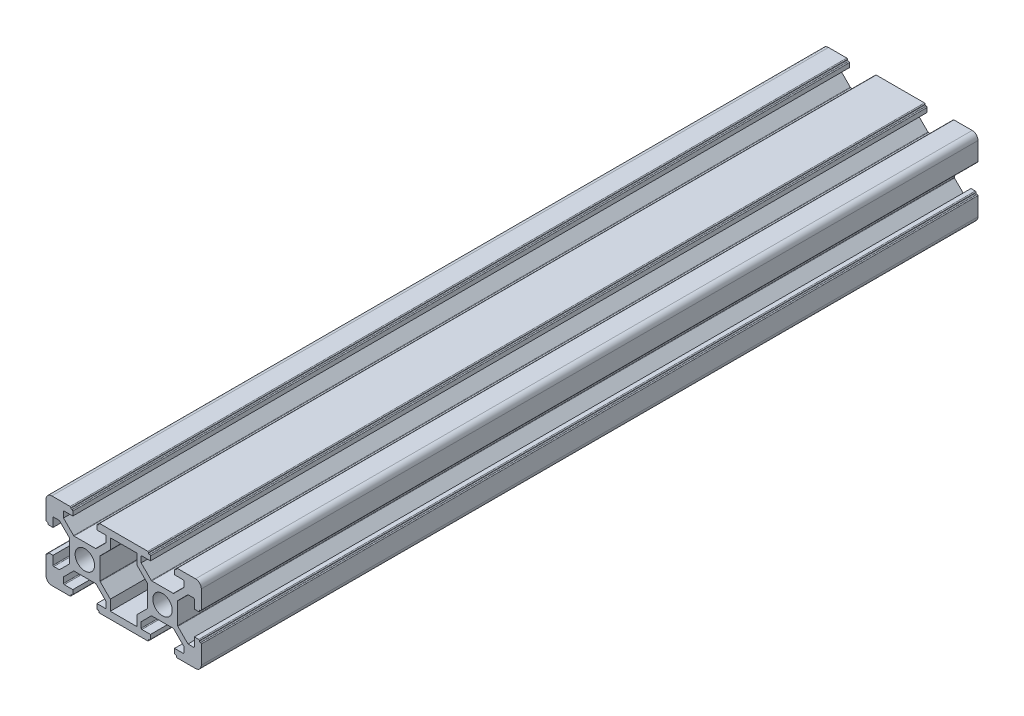
from build123d import *

# Parameters (mm, degrees)
BOSS_EXTRUDE1_DEPTH = 200
SKETCH2_R           = 2.5
CUT_EXTRUDE1_DEPTH  = 203.484567313
SKETCH3_R           = 1.5
CUT_EXTRUDE2_DEPTH  = 10


with BuildPart() as part:
    # Sketch1 → Boss-Extrude1 (new body)
    with BuildSketch(Plane.XY):
        with BuildLine():
            Line((-8.5, 10), (-3.8, 10))
            ThreePointArc((-3.8, 10), (-3.658578644, 9.941421356), (-3.6, 9.8))
            Line((-3.6, 9.8), (-3.6, 9.7))
            ThreePointArc((-3.6, 9.7), (-3.541421356, 9.558578644), (-3.4, 9.5))
            Line((-3.4, 9.5), (-3.3, 9.5))
            ThreePointArc((-3.3, 9.5), (-3.158578644, 9.441421356), (-3.1, 9.3))
            Line((-3.1, 9.3), (-3.1, 8.2))
            Line((-3.1, 8.2), (-5.3, 8.2))
            ThreePointArc((-5.3, 8.2), (-5.441421356, 8.141421356), (-5.5, 8))
            Line((-5.5, 8), (-5.5, 6.560660172))
            Line((-5.5, 6.560660172), (-2.897918472, 3.958578644))
            ThreePointArc((-2.897918472, 3.958578644), (-2.833033802, 3.915224093), (-2.756497116, 3.9))
            Line((-2.756497116, 3.9), (2.756497116, 3.9))
            ThreePointArc((2.756497116, 3.9), (2.833033802, 3.915224093), (2.897918472, 3.958578644))
            Line((2.897918472, 3.958578644), (5.5, 6.560660172))
            Line((5.5, 6.560660172), (5.5, 8))
            ThreePointArc((5.5, 8), (5.441421356, 8.141421356), (5.3, 8.2))
            Line((5.3, 8.2), (3.1, 8.2))
            Line((3.1, 8.2), (3.1, 9.3))
            ThreePointArc((3.1, 9.3), (3.158578644, 9.441421356), (3.3, 9.5))
            Line((3.3, 9.5), (3.4, 9.5))
            ThreePointArc((3.4, 9.5), (3.541421356, 9.558578644), (3.6, 9.7))
            Line((3.6, 9.7), (3.6, 9.8))
            ThreePointArc((3.6, 9.8), (3.658578644, 9.941421356), (3.8, 10))
            Line((3.8, 10), (8.5, 10))
            Line((8.5, 10), (11.5, 10))
            Line((11.5, 10), (16.2, 10))
            ThreePointArc((16.2, 10), (16.341421356, 9.941421356), (16.4, 9.8))
            Line((16.4, 9.8), (16.4, 9.7))
            ThreePointArc((16.4, 9.7), (16.458578644, 9.558578644), (16.6, 9.5))
            Line((16.6, 9.5), (16.7, 9.5))
            ThreePointArc((16.7, 9.5), (16.841421356, 9.441421356), (16.9, 9.3))
            Line((16.9, 9.3), (16.9, 8.2))
            Line((16.9, 8.2), (14.7, 8.2))
            ThreePointArc((14.7, 8.2), (14.558578644, 8.141421356), (14.5, 8))
            Line((14.5, 8), (14.5, 6.560660172))
            Line((14.5, 6.560660172), (17.102081528, 3.958578644))
            ThreePointArc((17.102081528, 3.958578644), (17.166966198, 3.915224093), (17.243502884, 3.9))
            Line((17.243502884, 3.9), (22.756497116, 3.9))
            ThreePointArc((22.756497116, 3.9), (22.833033802, 3.915224093), (22.897918472, 3.958578644))
            Line((22.897918472, 3.958578644), (25.5, 6.560660172))
            Line((25.5, 6.560660172), (25.5, 8))
            ThreePointArc((25.5, 8), (25.441421356, 8.141421356), (25.3, 8.2))
            Line((25.3, 8.2), (23.1, 8.2))
            Line((23.1, 8.2), (23.1, 9.3))
            ThreePointArc((23.1, 9.3), (23.158578644, 9.441421356), (23.3, 9.5))
            Line((23.3, 9.5), (23.4, 9.5))
            ThreePointArc((23.4, 9.5), (23.541421356, 9.558578644), (23.6, 9.7))
            Line((23.6, 9.7), (23.6, 9.8))
            ThreePointArc((23.6, 9.8), (23.658578644, 9.941421356), (23.8, 10))
            Line((23.8, 10), (28.5, 10))
            ThreePointArc((28.5, 10), (29.560660172, 9.560660172), (30, 8.5))
            Line((30, 8.5), (30, 3.8))
            ThreePointArc((30, 3.8), (29.941421356, 3.658578644), (29.8, 3.6))
            Line((29.8, 3.6), (29.7, 3.6))
            ThreePointArc((29.7, 3.6), (29.558578644, 3.541421356), (29.5, 3.4))
            Line((29.5, 3.4), (29.5, 3.3))
            ThreePointArc((29.5, 3.3), (29.441421356, 3.158578644), (29.3, 3.1))
            Line((29.3, 3.1), (28.2, 3.1))
            Line((28.2, 3.1), (28.2, 5.3))
            ThreePointArc((28.2, 5.3), (28.141421356, 5.441421356), (28, 5.5))
            Line((28, 5.5), (26.560660172, 5.5))
            Line((26.560660172, 5.5), (23.958578644, 2.897918472))
            ThreePointArc((23.958578644, 2.897918472), (23.915224093, 2.833033802), (23.9, 2.756497116))
            Line((23.9, 2.756497116), (23.9, -2.756497116))
            ThreePointArc((23.9, -2.756497116), (23.915224093, -2.833033802), (23.958578644, -2.897918472))
            Line((23.958578644, -2.897918472), (26.560660172, -5.5))
            Line((26.560660172, -5.5), (28, -5.5))
            ThreePointArc((28, -5.5), (28.141421356, -5.441421356), (28.2, -5.3))
            Line((28.2, -5.3), (28.2, -3.1))
            Line((28.2, -3.1), (29.3, -3.1))
            ThreePointArc((29.3, -3.1), (29.441421356, -3.158578644), (29.5, -3.3))
            Line((29.5, -3.3), (29.5, -3.4))
            ThreePointArc((29.5, -3.4), (29.558578644, -3.541421356), (29.7, -3.6))
            Line((29.7, -3.6), (29.8, -3.6))
            ThreePointArc((29.8, -3.6), (29.941421356, -3.658578644), (30, -3.8))
            Line((30, -3.8), (30, -8.5))
            ThreePointArc((30, -8.5), (29.560660172, -9.560660172), (28.5, -10))
            Line((28.5, -10), (23.8, -10))
            ThreePointArc((23.8, -10), (23.658578644, -9.941421356), (23.6, -9.8))
            Line((23.6, -9.8), (23.6, -9.7))
            ThreePointArc((23.6, -9.7), (23.541421356, -9.558578644), (23.4, -9.5))
            Line((23.4, -9.5), (23.3, -9.5))
            ThreePointArc((23.3, -9.5), (23.158578644, -9.441421356), (23.1, -9.3))
            Line((23.1, -9.3), (23.1, -8.2))
            Line((23.1, -8.2), (25.3, -8.2))
            ThreePointArc((25.3, -8.2), (25.441421356, -8.141421356), (25.5, -8))
            Line((25.5, -8), (25.5, -6.560660172))
            Line((25.5, -6.560660172), (22.897918472, -3.958578644))
            ThreePointArc((22.897918472, -3.958578644), (22.833033802, -3.915224093), (22.756497116, -3.9))
            Line((22.756497116, -3.9), (17.243502884, -3.9))
            ThreePointArc((17.243502884, -3.9), (17.166966198, -3.915224093), (17.102081528, -3.958578644))
            Line((17.102081528, -3.958578644), (14.5, -6.560660172))
            Line((14.5, -6.560660172), (14.5, -8))
            ThreePointArc((14.5, -8), (14.558578644, -8.141421356), (14.7, -8.2))
            Line((14.7, -8.2), (16.9, -8.2))
            Line((16.9, -8.2), (16.9, -9.3))
            ThreePointArc((16.9, -9.3), (16.841421356, -9.441421356), (16.7, -9.5))
            Line((16.7, -9.5), (16.6, -9.5))
            ThreePointArc((16.6, -9.5), (16.458578644, -9.558578644), (16.4, -9.7))
            Line((16.4, -9.7), (16.4, -9.8))
            ThreePointArc((16.4, -9.8), (16.341421356, -9.941421356), (16.2, -10))
            Line((16.2, -10), (11.5, -10))
            Line((11.5, -10), (8.5, -10))
            Line((8.5, -10), (3.8, -10))
            ThreePointArc((3.8, -10), (3.658578644, -9.941421356), (3.6, -9.8))
            Line((3.6, -9.8), (3.6, -9.7))
            ThreePointArc((3.6, -9.7), (3.541421356, -9.558578644), (3.4, -9.5))
            Line((3.4, -9.5), (3.3, -9.5))
            ThreePointArc((3.3, -9.5), (3.158578644, -9.441421356), (3.1, -9.3))
            Line((3.1, -9.3), (3.1, -8.2))
            Line((3.1, -8.2), (5.3, -8.2))
            ThreePointArc((5.3, -8.2), (5.441421356, -8.141421356), (5.5, -8))
            Line((5.5, -8), (5.5, -6.560660172))
            Line((5.5, -6.560660172), (2.897918472, -3.958578644))
            ThreePointArc((2.897918472, -3.958578644), (2.833033802, -3.915224093), (2.756497116, -3.9))
            Line((2.756497116, -3.9), (-2.756497116, -3.9))
            ThreePointArc((-2.756497116, -3.9), (-2.833033802, -3.915224093), (-2.897918472, -3.958578644))
            Line((-2.897918472, -3.958578644), (-5.5, -6.560660172))
            Line((-5.5, -6.560660172), (-5.5, -8))
            ThreePointArc((-5.5, -8), (-5.441421356, -8.141421356), (-5.3, -8.2))
            Line((-5.3, -8.2), (-3.1, -8.2))
            Line((-3.1, -8.2), (-3.1, -9.3))
            ThreePointArc((-3.1, -9.3), (-3.158578644, -9.441421356), (-3.3, -9.5))
            Line((-3.3, -9.5), (-3.4, -9.5))
            ThreePointArc((-3.4, -9.5), (-3.541421356, -9.558578644), (-3.6, -9.7))
            Line((-3.6, -9.7), (-3.6, -9.8))
            ThreePointArc((-3.6, -9.8), (-3.658578644, -9.941421356), (-3.8, -10))
            Line((-3.8, -10), (-8.5, -10))
            ThreePointArc((-8.5, -10), (-9.560660172, -9.560660172), (-10, -8.5))
            Line((-10, -8.5), (-10, -3.8))
            ThreePointArc((-10, -3.8), (-9.941421356, -3.658578644), (-9.8, -3.6))
            Line((-9.8, -3.6), (-9.7, -3.6))
            ThreePointArc((-9.7, -3.6), (-9.558578644, -3.541421356), (-9.5, -3.4))
            Line((-9.5, -3.4), (-9.5, -3.3))
            ThreePointArc((-9.5, -3.3), (-9.441421356, -3.158578644), (-9.3, -3.1))
            Line((-9.3, -3.1), (-8.2, -3.1))
            Line((-8.2, -3.1), (-8.2, -5.3))
            ThreePointArc((-8.2, -5.3), (-8.141421356, -5.441421356), (-8, -5.5))
            Line((-8, -5.5), (-6.560660172, -5.5))
            Line((-6.560660172, -5.5), (-3.958578644, -2.897918472))
            ThreePointArc((-3.958578644, -2.897918472), (-3.915224093, -2.833033802), (-3.9, -2.756497116))
            Line((-3.9, -2.756497116), (-3.9, 2.756497116))
            ThreePointArc((-3.9, 2.756497116), (-3.915224093, 2.833033802), (-3.958578644, 2.897918472))
            Line((-3.958578644, 2.897918472), (-6.560660172, 5.5))
            Line((-6.560660172, 5.5), (-8, 5.5))
            ThreePointArc((-8, 5.5), (-8.141421356, 5.441421356), (-8.2, 5.3))
            Line((-8.2, 5.3), (-8.2, 3.1))
            Line((-8.2, 3.1), (-9.3, 3.1))
            ThreePointArc((-9.3, 3.1), (-9.441421356, 3.158578644), (-9.5, 3.3))
            Line((-9.5, 3.3), (-9.5, 3.4))
            ThreePointArc((-9.5, 3.4), (-9.558578644, 3.541421356), (-9.7, 3.6))
            Line((-9.7, 3.6), (-9.8, 3.6))
            ThreePointArc((-9.8, 3.6), (-9.941421356, 3.658578644), (-10, 3.8))
            Line((-10, 3.8), (-10, 8.5))
            ThreePointArc((-10, 8.5), (-9.560660172, 9.560660172), (-8.5, 10))
        make_face()
        with BuildLine():
            Line((3.9, 2.756497116), (3.9, -2.756497116))
            ThreePointArc((3.9, -2.756497116), (3.915224093, -2.833033802), (3.958578644, -2.897918472))
            Line((3.958578644, -2.897918472), (6.560660172, -5.5))
            Line((6.560660172, -5.5), (6.560660172, -8.2))
            Line((6.560660172, -8.2), (13.439339828, -8.2))
            Line((13.439339828, -8.2), (13.439339828, -5.5))
            Line((13.439339828, -5.5), (16.041421356, -2.897918472))
            ThreePointArc((16.041421356, -2.897918472), (16.084775907, -2.833033802), (16.1, -2.756497116))
            Line((16.1, -2.756497116), (16.1, 2.756497116))
            ThreePointArc((16.1, 2.756497116), (16.084775907, 2.833033802), (16.041421356, 2.897918472))
            Line((16.041421356, 2.897918472), (13.439339828, 5.5))
            Line((13.439339828, 5.5), (13.439339828, 8.2))
            Line((13.439339828, 8.2), (6.560660172, 8.2))
            Line((6.560660172, 8.2), (6.560660172, 5.5))
            Line((6.560660172, 5.5), (3.958578644, 2.897918472))
            ThreePointArc((3.958578644, 2.897918472), (3.915224093, 2.833033802), (3.9, 2.756497116))
        make_face(mode=Mode.SUBTRACT)
    extrude(amount=BOSS_EXTRUDE1_DEPTH)

    # Sketch2 → Cut-Extrude1 (cut, through all)
    with BuildSketch(Plane.XY.offset(200)):
        Circle(SKETCH2_R)
        with Locations(Location((20, 0, 0), (0, 0, 180))):
            Circle(SKETCH2_R)
    extrude(amount=-CUT_EXTRUDE1_DEPTH, mode=Mode.SUBTRACT)

    # Sketch3 → Cut-Extrude2 (cut)
    with BuildSketch(Plane.XZ.offset(3.9)):
        with Locations((20, 183.3)):
            Circle(SKETCH3_R)
        with Locations((20, 166.6)):
            Circle(SKETCH3_R)
        with Locations((0, 166.6)):
            Circle(SKETCH3_R)
        with Locations((0, 183.3)):
            Circle(SKETCH3_R)
    extrude(amount=-CUT_EXTRUDE2_DEPTH, mode=Mode.SUBTRACT)


solid = part.part
